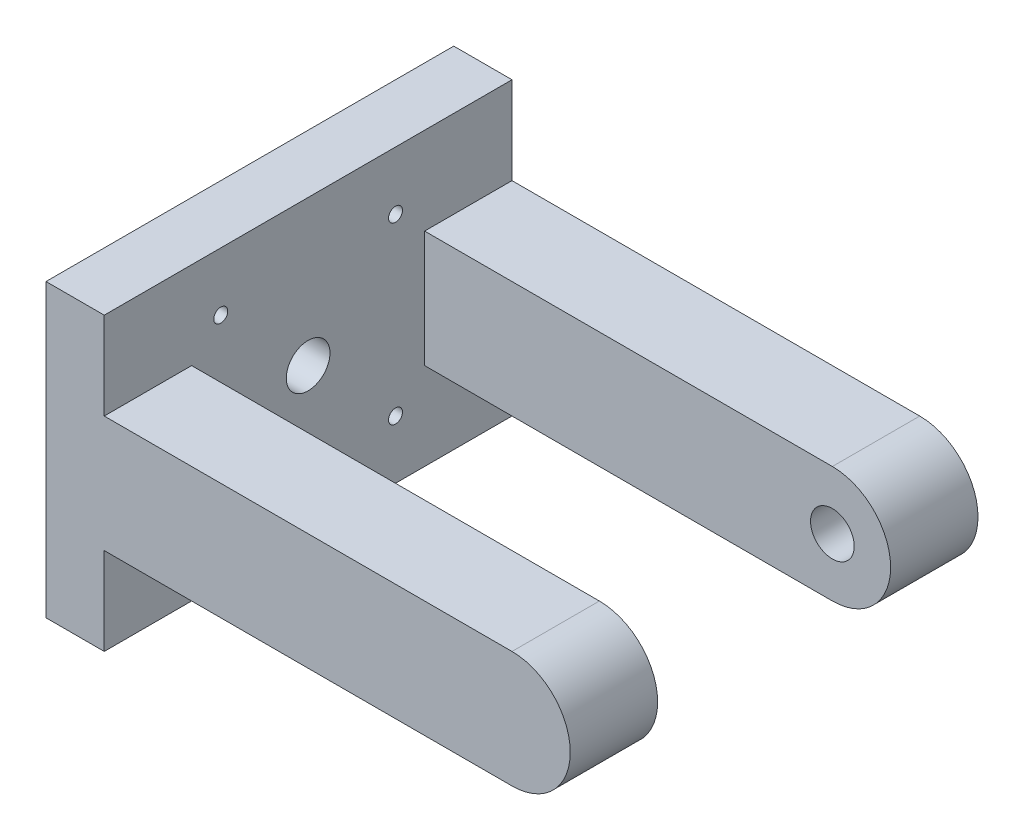
from build123d import *

# Parameters (mm, degrees)
BOSS_EXTRUDE1_DEPTH                             = 70
SKETCH2_W                                       = 100.495668723
SKETCH2_H                                       = 40
CUT_EXTRUDE1_DEPTH                              = 91.277350426
SKETCH3_R                                       = 3.75
CUT_EXTRUDE2_DEPTH                              = 10
SKETCH4_R                                       = 3.75
CUT_EXTRUDE3_DEPTH                              = 10
SKETCH5_R                                       = 3.75
CUT_EXTRUDE4_DEPTH                              = 110.201648339
CSK_FOR_M2_FLAT_HEAD_MACHINE_SCREW1_D           = 2.4
CSK_FOR_M2_FLAT_HEAD_MACHINE_SCREW1_CSINK_D     = 4.4
CSK_FOR_M2_FLAT_HEAD_MACHINE_SCREW1_CSINK_ANGLE = 90


with BuildPart() as part:
    # Sketch1 → Boss-Extrude1 (new body)
    with BuildSketch(Plane.XY):
        with BuildLine():
            Line((-35, 10), (-35, 25))
            Line((-35, 25), (-45, 25))
            Line((-45, 25), (-45, -25))
            Line((-45, -25), (-35, -25))
            Line((-35, -25), (-35, -10))
            Line((-35, -10), (35, -10))
            ThreePointArc((35, -10), (45, 0), (35, 10))
            Line((35, 10), (-35, 10))
        make_face()
    extrude(amount=-BOSS_EXTRUDE1_DEPTH)

    # Sketch2 → Cut-Extrude1 (cut, through all)
    with BuildSketch(Plane(origin=(0, 10, 0), x_dir=(1, 0, 0), z_dir=(0, 1, 0))):
        with Locations((15.247834362, 35)):
            Rectangle(SKETCH2_W, SKETCH2_H)
    extrude(amount=-CUT_EXTRUDE1_DEPTH, mode=Mode.SUBTRACT)

    # Sketch3 → Cut-Extrude2 (cut)
    with BuildSketch(Plane.XY.offset(-55)):
        with Locations((35, 0)):
            Circle(SKETCH3_R)
    extrude(amount=-CUT_EXTRUDE2_DEPTH, mode=Mode.SUBTRACT)

    # Sketch4 → Cut-Extrude3 (cut)
    with BuildSketch(Plane(origin=(0, 0, -15), x_dir=(-1, 0, 0), z_dir=(0, 0, -1))):
        with Locations((-33.885516641, 0)):
            Circle(SKETCH4_R)
    extrude(amount=-CUT_EXTRUDE3_DEPTH, mode=Mode.SUBTRACT)

    # Sketch5 → Cut-Extrude4 (cut, through all)
    with BuildSketch(Plane(origin=(-35, 0, 0), x_dir=(0, 0, -1), z_dir=(1, 0, 0))):
        with Locations((35, 0)):
            Circle(SKETCH5_R)
    extrude(amount=-CUT_EXTRUDE4_DEPTH, mode=Mode.SUBTRACT)

    # CSK for M2 Flat Head Machine Screw1 (through all)
    with Locations(Plane.ZY.offset(45)):
        with Locations((-50, 15), (-20, 15), (-20, -15), (-50, -15)):
            CounterSinkHole(CSK_FOR_M2_FLAT_HEAD_MACHINE_SCREW1_D / 2, CSK_FOR_M2_FLAT_HEAD_MACHINE_SCREW1_CSINK_D / 2, counter_sink_angle=CSK_FOR_M2_FLAT_HEAD_MACHINE_SCREW1_CSINK_ANGLE)


solid = part.part
